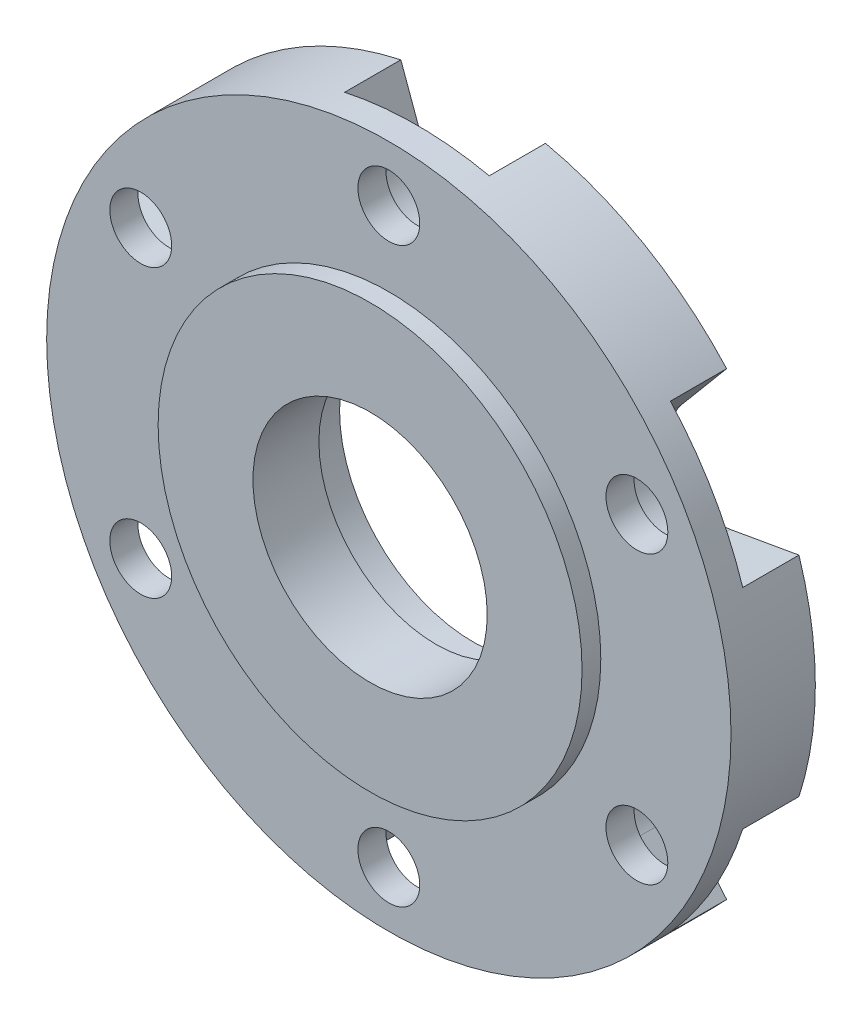
from build123d import *

# Parameters (mm, degrees)
CUT_CENTER_DEPTH               = 53.414934066
CUT_CENTER_DEPTH_BACK          = 53.414934066
SKETCH_CENTER_CUT_R            = 12.5
CBORE_FOR_M6_SHCS1_D           = 6.6
CBORE_FOR_M6_SHCS1_CBORE_D     = 11
CBORE_FOR_M6_SHCS1_CBORE_DEPTH = 6
CIRPATTERN1_COUNT              = 6
SKETCH1_R                      = 14.25575
CUT_EXTRUDE1_DEPTH             = 3.9624
CUT_EXTRUDE2_DEPTH             = 6
CIRPATTERN2_COUNT              = 6


with BuildPart() as part:
    # Sketch Spindle Skeleton → Main Revolve (revolve)
    with BuildSketch(Plane(origin=(0, 0, 0), x_dir=(0, 0, -1), z_dir=(1, 0, 0)), mode=Mode.PRIVATE) as main_revolve_sk:
        Polygon((-26.320999936, -22.6187), (-26.320999936, -36.5125), (-17.320999902, -36.5125), (-17.320999902, -9.525), (-26.320999936, -9.525), (-26.320999936, -12.5), (-28.321, -12.5), (-28.321, -22.6187), align=None)
        Polygon((-26.320999936, 36.5125), (-26.320999936, 22.6187), (-28.321, 22.6187), (-28.321, 12.5), (-26.320999936, 12.5), (-26.320999936, 9.525), (-17.320999902, 9.525), (-17.320999902, 36.5125), align=None)
    revolve(main_revolve_sk.sketch.rotate(Axis((0, 0, 1000), (0, 0, -1)), 270), axis=Axis((0, 0, 1000), (0, 0, -1)))

    # Sketch Center Cut → Cut Center (cut, two sides: drawn at the far end of the back side and taken through both)
    with BuildSketch(Plane.XY.offset(26.320999936).offset(-CUT_CENTER_DEPTH_BACK)):
        Circle(SKETCH_CENTER_CUT_R)
    extrude(amount=CUT_CENTER_DEPTH + CUT_CENTER_DEPTH_BACK, mode=Mode.SUBTRACT)

    # CBORE for M6 SHCS1 (through all)
    with Locations(Plane(origin=(0, 0, 17.320999902), x_dir=(-1, 0, 0), z_dir=(0, 0, -1))):
        with Locations((0, 30.565600032)):
            cbore_for_m6_shcs1 = CounterBoreHole(CBORE_FOR_M6_SHCS1_D / 2, CBORE_FOR_M6_SHCS1_CBORE_D / 2, CBORE_FOR_M6_SHCS1_CBORE_DEPTH)

    # CirPattern1: CBORE for M6 SHCS1 ×6 about axis
    cirpattern1_axis = Axis((0, 0, 0), (0, 0, 1))
    for i in range(1, CIRPATTERN1_COUNT):
        add(cbore_for_m6_shcs1.rotate(cirpattern1_axis, i * 360 / CIRPATTERN1_COUNT), mode=Mode.SUBTRACT)

    # Sketch1 → Cut-Extrude1 (cut)
    with BuildSketch(Plane(origin=(0, 0, 17.320999902), x_dir=(-1, 0, 0), z_dir=(0, 0, -1))):
        Circle(SKETCH1_R)
    extrude(amount=-CUT_EXTRUDE1_DEPTH, mode=Mode.SUBTRACT)

    # Sketch2 → Cut-Extrude2 (cut)
    with BuildSketch(Plane(origin=(0, 0, 17.320999902), x_dir=(-1, 0, 0), z_dir=(0, 0, -1))):
        with BuildLine():
            ThreePointArc((5.5, 30.565600032), (5.416442642, 29.610535055), (5.168309414, 28.684489244))
            Line((5.168309414, 28.684489244), (7.71724355, 35.687628224))
            ThreePointArc((7.71724355, 35.687628224), (3.88060116, 36.305696397), (0, 36.5125))
            Line((0, 36.5125), (0, 36.065600032))
            ThreePointArc((0, 36.065600032), (3.889087297, 34.454687329), (5.5, 30.565600032))
        make_face()
        with BuildLine():
            Line((-7.71724355, 35.687628224), (-5.168309414, 28.684489244))
            ThreePointArc((-5.168309414, 28.684489244), (-4.505336244, 33.720270432), (0, 36.065600032))
            Line((0, 36.065600032), (0, 36.5125))
            ThreePointArc((0, 36.5125), (-3.88060116, 36.305696397), (-7.71724355, 35.687628224))
        make_face()
    cut_extrude2 = extrude(amount=-CUT_EXTRUDE2_DEPTH, mode=Mode.SUBTRACT)

    # CirPattern2: Cut-Extrude2 ×6 about axis
    cirpattern2_axis = Axis((0, 0, 0), (0, 0, 1))
    for i in range(1, CIRPATTERN2_COUNT):
        add(cut_extrude2.rotate(cirpattern2_axis, i * 360 / CIRPATTERN2_COUNT), mode=Mode.SUBTRACT)


solid = part.part
